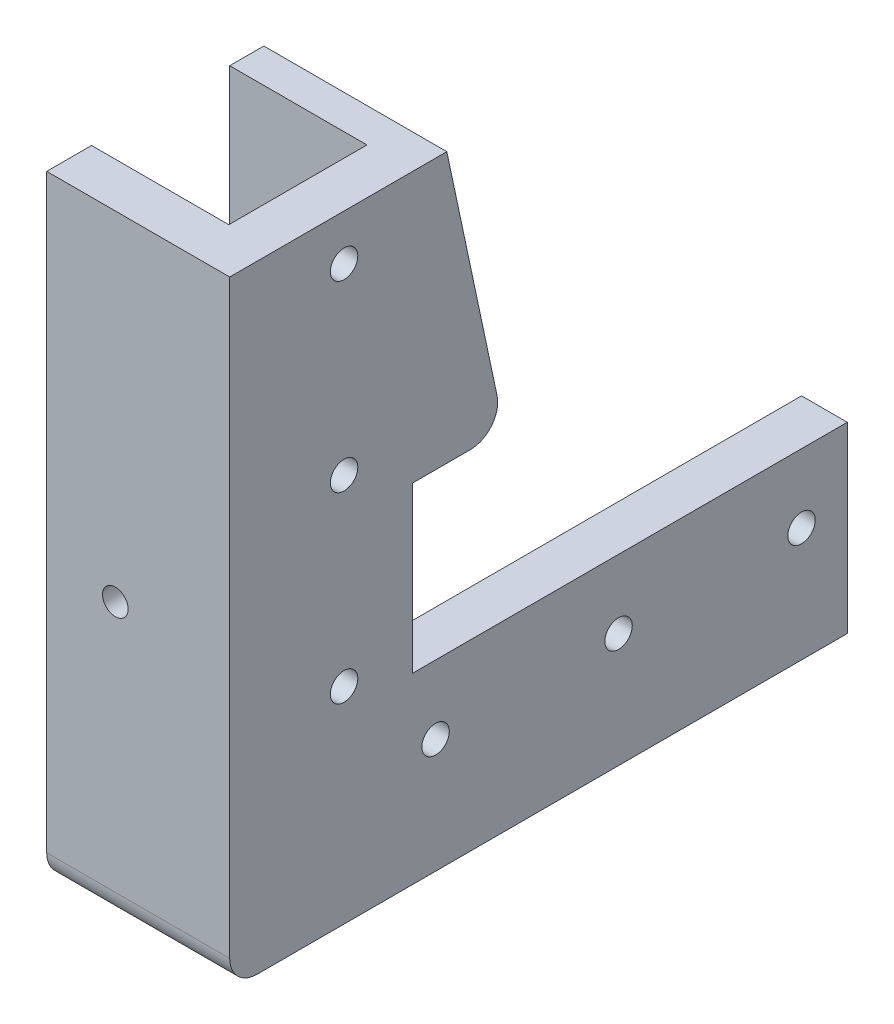
from build123d import *

# Parameters (mm, degrees)
SKETCH_1_R          = 1.5
EXTRUDE_1_DEPTH     = 20
CUT_EXTRUDE_1_DEPTH = 15
SKETCH_3_R          = 1.4
CUT_EXTRUDE_2_DEPTH = 86.695740851
FILLET_1_R          = 3


with BuildPart() as part:
    # 草图1 → 凸台-拉伸1 (new body)
    with BuildSketch(Plane(origin=(0, 0, 0), x_dir=(0, 0, -1), z_dir=(1, 0, 0))):
        Polygon((-12.5, -12.5), (55, -12.5), (55, 7.5), (7.5, 7.5), (7.5, 25.5), (17.5, 25.5), (11.229581431, 55), (-12.5, 55), align=None)
        with Locations((0, 10)):
            Circle(SKETCH_1_R, mode=Mode.SUBTRACT)
        with Locations((0, 30)):
            Circle(SKETCH_1_R, mode=Mode.SUBTRACT)
        with Locations((10, 0)):
            Circle(SKETCH_1_R, mode=Mode.SUBTRACT)
        with Locations((30, 0)):
            Circle(SKETCH_1_R, mode=Mode.SUBTRACT)
        with Locations((50, 0)):
            Circle(SKETCH_1_R, mode=Mode.SUBTRACT)
        with Locations((0, 50)):
            Circle(SKETCH_1_R, mode=Mode.SUBTRACT)
    extrude(amount=EXTRUDE_1_DEPTH)

    # 草图2 → 切除-拉伸1 (cut)
    with BuildSketch(Plane.ZY):
        Polygon((7.6, 55), (7.6, -7.6), (-55, -7.6), (-55, 7.5), (-7.5, 7.5), (-7.5, 55), align=None)
    extrude(amount=-CUT_EXTRUDE_1_DEPTH, mode=Mode.SUBTRACT)

    # 草图3 → 切除-拉伸2 (cut, through all)
    with BuildSketch(Plane(origin=(0, 0, 7.6), x_dir=(-1, 0, 0), z_dir=(0, 0, -1))):
        with Locations(Location((-7.5, 18, 0), (0, 0, 90))):
            Circle(SKETCH_3_R)
    extrude(amount=-CUT_EXTRUDE_2_DEPTH, mode=Mode.SUBTRACT)

    # 圆角1
    fillet_1_edges = [part.edges().sort_by_distance(p)[0] for p in [
        (10, -12.5, 12.5),
        (10, 25.5, -17.5),
    ]]
    fillet(fillet_1_edges, radius=FILLET_1_R)


solid = part.part
